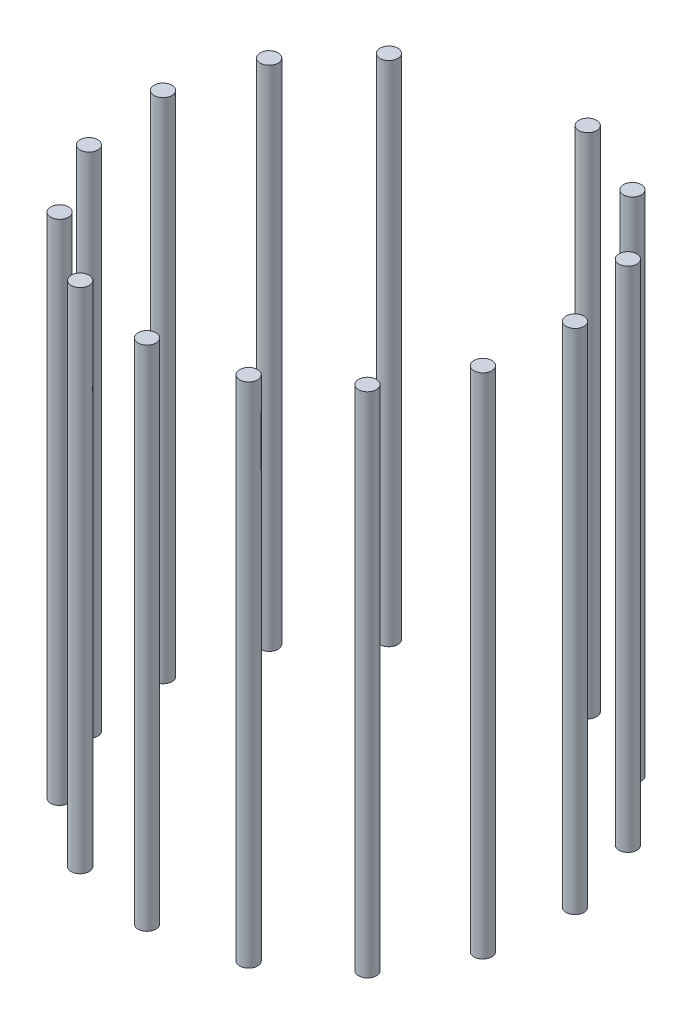
from build123d import *

# Parameters (mm, degrees)
SKETCH1_R              = 0.35
BOSS_EXTRUDE1_DEPTH    = 19.9
BOSS_EXTRUDE1_2_DEPTH  = 19.9
BOSS_EXTRUDE1_3_DEPTH  = 19.9
BOSS_EXTRUDE1_4_DEPTH  = 19.9
BOSS_EXTRUDE1_5_DEPTH  = 19.9
BOSS_EXTRUDE1_6_DEPTH  = 19.9
BOSS_EXTRUDE1_7_DEPTH  = 19.9
BOSS_EXTRUDE1_8_DEPTH  = 19.9
BOSS_EXTRUDE1_9_DEPTH  = 19.9
BOSS_EXTRUDE1_10_DEPTH = 19.9
BOSS_EXTRUDE1_11_DEPTH = 19.9
BOSS_EXTRUDE1_12_DEPTH = 19.9
BOSS_EXTRUDE1_13_DEPTH = 19.9
BOSS_EXTRUDE1_14_DEPTH = 19.9


with BuildPart() as part:
    # Sketch1 → Boss-Extrude1 (new body)
    with BuildSketch(Plane(origin=(0, 0, 0), x_dir=(1, 0, 0), z_dir=(0, 1, 0))):
        with Locations(Location((15.754167044, 6.229468681, 0), (0, 0, 270))):
            Circle(SKETCH1_R)
    extrude(amount=BOSS_EXTRUDE1_DEPTH)


with BuildPart() as body_2:
    # Sketch1 → Boss-Extrude1 2 (new body)
    with BuildSketch(Plane(origin=(0, 0, 0), x_dir=(1, 0, 0), z_dir=(0, 1, 0))):
        with Locations(Location((18.813056228, 4.922036699, 0), (0, 0, 270))):
            Circle(SKETCH1_R)
    extrude(amount=BOSS_EXTRUDE1_2_DEPTH)


with BuildPart() as body_3:
    # Sketch1 → Boss-Extrude1 3 (new body)
    with BuildSketch(Plane(origin=(0, 0, 0), x_dir=(1, 0, 0), z_dir=(0, 1, 0))):
        with Locations(Location((21.075710051, 2.483475833, 0), (0, 0, 270))):
            Circle(SKETCH1_R)
    extrude(amount=BOSS_EXTRUDE1_3_DEPTH)


with BuildPart() as body_4:
    # Sketch1 → Boss-Extrude1 4 (new body)
    with BuildSketch(Plane(origin=(0, 0, 0), x_dir=(1, 0, 0), z_dir=(0, 1, 0))):
        with Locations(Location((22.150895113, -0.66456459, 0), (0, 0, 270))):
            Circle(SKETCH1_R)
    extrude(amount=BOSS_EXTRUDE1_4_DEPTH)


with BuildPart() as body_5:
    # Sketch1 → Boss-Extrude1 5 (new body)
    with BuildSketch(Plane(origin=(0, 0, 0), x_dir=(1, 0, 0), z_dir=(0, 1, 0))):
        with Locations(Location((21.852702148, -3.977759781, 0), (0, 0, 270))):
            Circle(SKETCH1_R)
    extrude(amount=BOSS_EXTRUDE1_5_DEPTH)


with BuildPart() as body_6:
    # Sketch1 → Boss-Extrude1 6 (new body)
    with BuildSketch(Plane(origin=(0, 0, 0), x_dir=(1, 0, 0), z_dir=(0, 1, 0))):
        with Locations(Location((20.23269143, -6.883228194, 0), (0, 0, 270))):
            Circle(SKETCH1_R)
    extrude(amount=BOSS_EXTRUDE1_6_DEPTH)


with BuildPart() as body_7:
    # Sketch1 → Boss-Extrude1 7 (new body)
    with BuildSketch(Plane(origin=(0, 0, 0), x_dir=(1, 0, 0), z_dir=(0, 1, 0))):
        with Locations(Location((17.570977529, -8.878587943, 0), (0, 0, 270))):
            Circle(SKETCH1_R)
    extrude(amount=BOSS_EXTRUDE1_7_DEPTH)


with BuildPart() as body_8:
    # Sketch1 → Boss-Extrude1 8 (new body)
    with BuildSketch(Plane(origin=(0, 0, 0), x_dir=(1, 0, 0), z_dir=(0, 1, 0))):
        with Locations(Location((14.327794958, -9.618823201, 0), (0, 0, 270))):
            Circle(SKETCH1_R)
    extrude(amount=BOSS_EXTRUDE1_8_DEPTH)


with BuildPart() as body_9:
    # Sketch1 → Boss-Extrude1 9 (new body)
    with BuildSketch(Plane(origin=(0, 0, 0), x_dir=(1, 0, 0), z_dir=(0, 1, 0))):
        with Locations(Location((11.063919449, -8.975940567, 0), (0, 0, 270))):
            Circle(SKETCH1_R)
    extrude(amount=BOSS_EXTRUDE1_9_DEPTH)


with BuildPart() as body_10:
    # Sketch1 → Boss-Extrude1 10 (new body)
    with BuildSketch(Plane(origin=(0, 0, 0), x_dir=(1, 0, 0), z_dir=(0, 1, 0))):
        with Locations(Location((8.343704727, -7.061100288, 0), (0, 0, 270))):
            Circle(SKETCH1_R)
    extrude(amount=BOSS_EXTRUDE1_10_DEPTH)


with BuildPart() as body_11:
    # Sketch1 → Boss-Extrude1 11 (new body)
    with BuildSketch(Plane(origin=(0, 0, 0), x_dir=(1, 0, 0), z_dir=(0, 1, 0))):
        with Locations(Location((6.637500632, -4.205395646, 0), (0, 0, 270))):
            Circle(SKETCH1_R)
    extrude(amount=BOSS_EXTRUDE1_11_DEPTH)


with BuildPart() as body_12:
    # Sketch1 → Boss-Extrude1 12 (new body)
    with BuildSketch(Plane(origin=(0, 0, 0), x_dir=(1, 0, 0), z_dir=(0, 1, 0))):
        with Locations(Location((6.24032535, -0.902603915, 0), (0, 0, 270))):
            Circle(SKETCH1_R)
    extrude(amount=BOSS_EXTRUDE1_12_DEPTH)


with BuildPart() as body_13:
    # Sketch1 → Boss-Extrude1 13 (new body)
    with BuildSketch(Plane(origin=(0, 0, 0), x_dir=(1, 0, 0), z_dir=(0, 1, 0))):
        with Locations(Location((7.220854097, 2.276192209, 0), (0, 0, 270))):
            Circle(SKETCH1_R)
    extrude(amount=BOSS_EXTRUDE1_13_DEPTH)


with BuildPart() as body_14:
    # Sketch1 → Boss-Extrude1 14 (new body)
    with BuildSketch(Plane(origin=(0, 0, 0), x_dir=(1, 0, 0), z_dir=(0, 1, 0))):
        with Locations(Location((9.409544545, 4.781349998, 0), (0, 0, 270))):
            Circle(SKETCH1_R)
    extrude(amount=BOSS_EXTRUDE1_14_DEPTH)


solid = Compound([part.part, body_2.part, body_3.part, body_4.part, body_5.part, body_6.part, body_7.part, body_8.part, body_9.part, body_10.part, body_11.part, body_12.part, body_13.part, body_14.part])
